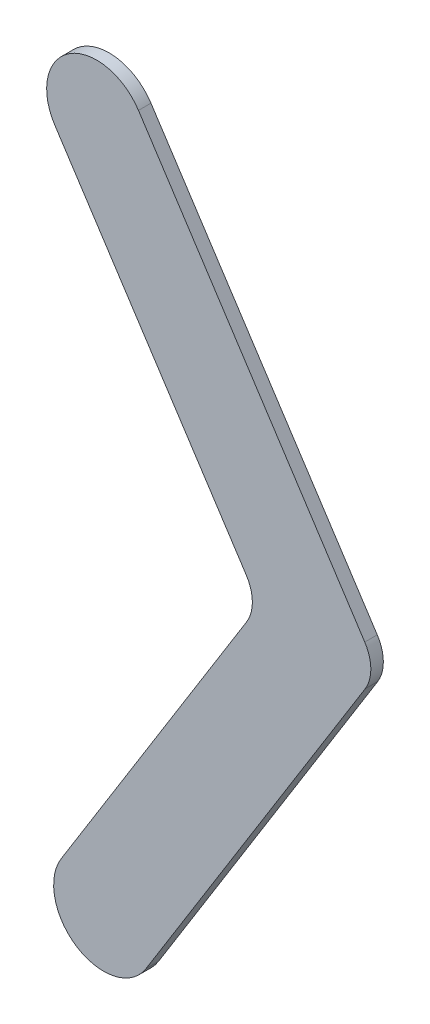
from build123d import *

# Parameters (mm, degrees)
BOSS_EXTRUDE1_DEPTH = 1
FILLET2_R           = 3


with BuildPart() as part:
    # Sketch1 → Boss-Extrude1 (new body)
    with BuildSketch(Plane.XY):
        with BuildLine():
            Line((0, 0), (-15.859714544, -25.465063412))
            ThreePointArc((-15.859714544, -25.465063412), (-14.579001361, -30.975033806), (-9.069030967, -29.694320624))
            Line((-9.069030967, -29.694320624), (9.485017571, 0.096885346))
            Line((9.485017571, 0.096885346), (-9.673704642, 29.502871699))
            ThreePointArc((-9.673704642, 29.502871699), (-15.208686496, 30.670765479), (-16.376580276, 25.135783626))
            Line((-16.376580276, 25.135783626), (0, 0))
        make_face()
    extrude(amount=BOSS_EXTRUDE1_DEPTH)

    # Fillet2
    fillet2_edges = [part.edges().sort_by_distance(p)[0] for p in [
        (9.485017571, 0.096885346, 0.5),
        (0, 0, 0.5),
    ]]
    fillet(fillet2_edges, radius=FILLET2_R)


solid = part.part
